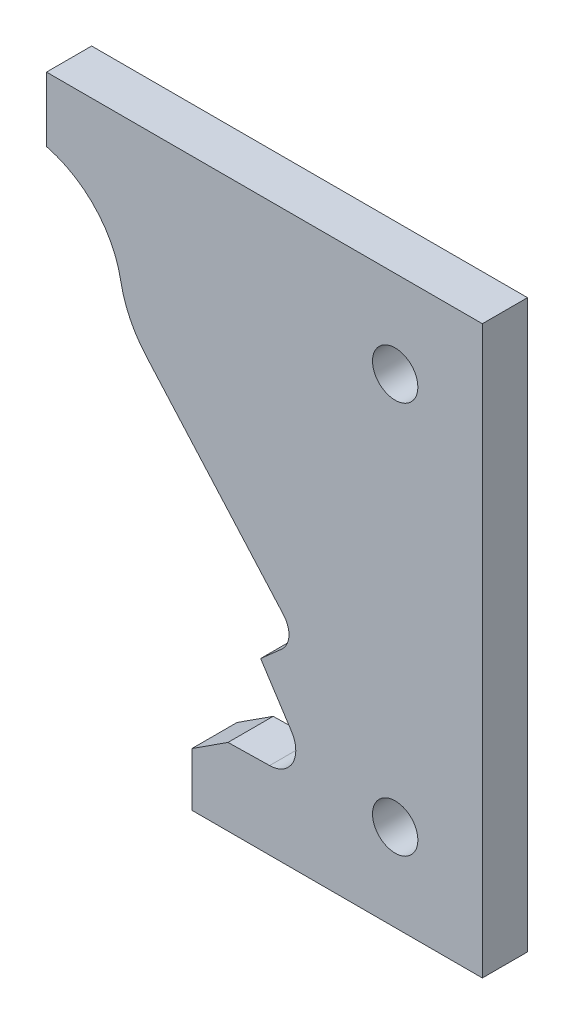
from build123d import *

# Parameters (mm, degrees)
BOSS_EXTRUDE2_DEPTH        = 3.2893
FILLET4_R                  = 3.175
F_97_0_26_DIAMETER_HOLE1_D = 6.604


with BuildPart() as part:
    # Sketch1 → Boss-Extrude2 (new, symmetric)
    with BuildSketch(Plane.XY):
        with BuildLine():
            Line((40.245218881, -29.952840417), (34.814702315, -34.75119179))
            Line((34.814702315, -34.75119179), (36.859912069, -37.911424085))
            Line((36.859912069, -37.911424085), (39.325632445, -41.721424085))
            ThreePointArc((39.325632445, -41.721424085), (39.47389391, -45.61207473), (36.127033373, -47.601463693))
            Line((36.127033373, -47.601463693), (30.06004247, -47.717842457))
            Line((30.06004247, -47.717842457), (24.793517597, -51.126183057))
            Line((24.793517597, -51.126183057), (24.793517597, -58.914319794))
            Line((24.793517597, -58.914319794), (50.193517597, -58.914319794))
            Line((50.193517597, -58.914319794), (67.115922286, -58.914319794))
            Line((67.115922286, -58.914319794), (67.115922286, 23.635680206))
            Line((67.115922286, 23.635680206), (3.615922286, 23.635680206))
            Line((3.615922286, 23.635680206), (3.615922286, 14.236541628))
            ThreePointArc((3.615922286, 14.236541628), (10.763958516, 9.998143491), (14.46505327, 2.557690661))
            ThreePointArc((14.46505327, 2.557690661), (15.807885527, -1.447488843), (18.159107069, -4.956964385))
            Line((18.159107069, -4.956964385), (40.245218881, -29.952840417))
        make_face()
    extrude(amount=BOSS_EXTRUDE2_DEPTH, both=True)

    # Fillet4
    fillet4_edges = [part.edges().sort_by_distance(p)[0] for p in [
        (40.245218881, -29.952840417, 0),
    ]]
    fillet(fillet4_edges, radius=FILLET4_R)

    # #97 (0.26) Diameter Hole1 (through all)
    with Locations(Plane(origin=(54.415922286, 10.935680206, 3.2893), x_dir=(1, 0, 0), z_dir=(0, 0, 1))):
        with Locations((0, 0), (0, -57.15)):
            Hole(F_97_0_26_DIAMETER_HOLE1_D / 2)


solid = part.part
